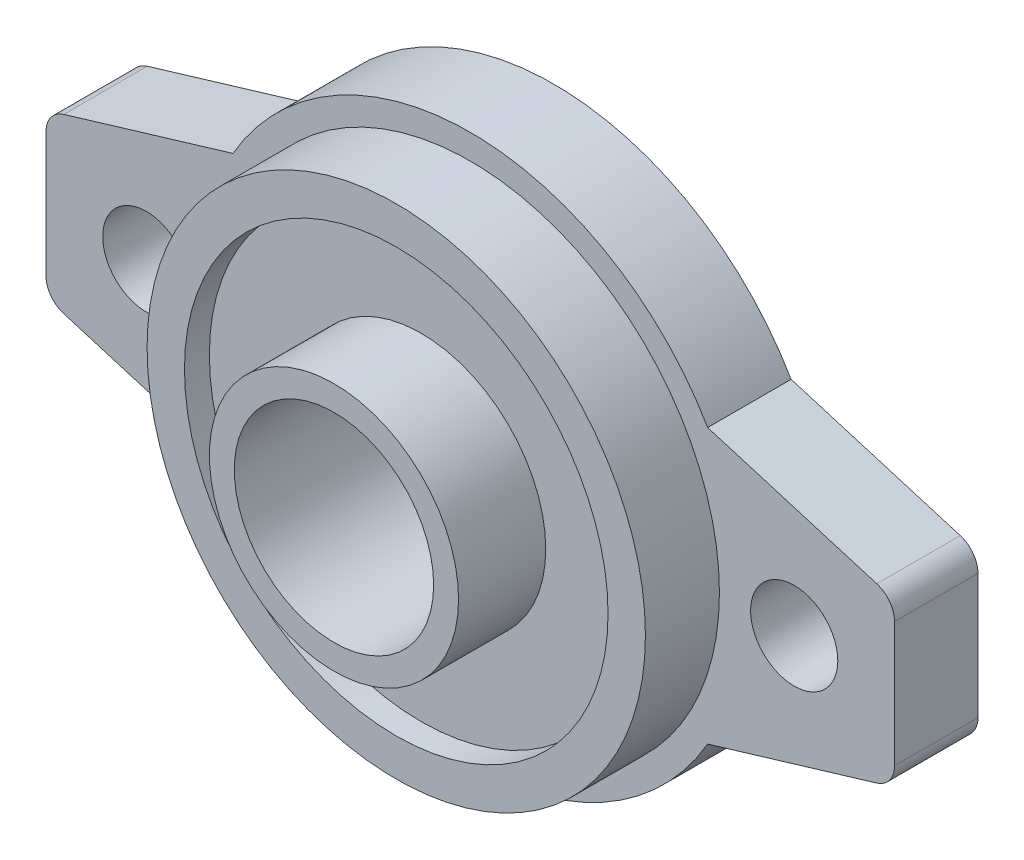
from build123d import *

# Parameters (mm, degrees)
SKETCH_1_R      = 10
SKETCH_1_R_2    = 3.5
EXTRUDE_1_DEPTH = 6.7
SKETCH_1_4_R    = 20
SKETCH_1_4_R_2  = 17
EXTRUDE_2_DEPTH = 12.64
SKETCH_1_5_R    = 17
SKETCH_1_5_R_2  = 10
EXTRUDE_3_DEPTH = 10.64
SKETCH_1_6_R    = 10
SKETCH_1_6_R_2  = 8
EXTRUDE_4_DEPTH = 17.64
FILLET_1_R      = 2


with BuildPart() as part:
    # 스케치1 → 보스-돌출1 (new body)
    with BuildSketch(Plane.XY):
        with BuildLine():
            Line((19.052558883, 11), (34.052558883, 6.5))
            Line((34.052558883, 6.5), (34.052558883, -6.5))
            Line((34.052558883, -6.5), (19.052558883, -11))
            ThreePointArc((19.052558883, -11), (0, -22), (-19.052558883, -11))
            Line((-19.052558883, -11), (-34.052558883, -6.5))
            Line((-34.052558883, -6.5), (-34.052558883, 6.5))
            Line((-34.052558883, 6.5), (-19.052558883, 11))
            ThreePointArc((-19.052558883, 11), (0, 22), (19.052558883, 11))
        make_face()
        Circle(SKETCH_1_R, mode=Mode.SUBTRACT)
        with Locations((26, 0)):
            Circle(SKETCH_1_R_2, mode=Mode.SUBTRACT)
        with Locations((-26, 0)):
            Circle(SKETCH_1_R_2, mode=Mode.SUBTRACT)
    extrude(amount=EXTRUDE_1_DEPTH)

    # 스케치1<4> → 보스-돌출2 (add)
    with BuildSketch(Plane.XY):
        with Locations(Location((0, 0, 0), (0, 0, 180))):
            Circle(SKETCH_1_4_R)
        with Locations(Location((0, 0, 0), (0, 0, 180))):
            Circle(SKETCH_1_4_R_2, mode=Mode.SUBTRACT)
    extrude(amount=EXTRUDE_2_DEPTH)

    # 스케치1<5> → 보스-돌출3 (add)
    with BuildSketch(Plane.XY):
        with Locations(Location((0, 0, 0), (0, 0, 180))):
            Circle(SKETCH_1_5_R)
        Circle(SKETCH_1_5_R_2, mode=Mode.SUBTRACT)
    extrude(amount=EXTRUDE_3_DEPTH)

    # 스케치1<6> → 보스-돌출4 (add)
    with BuildSketch(Plane.XY):
        Circle(SKETCH_1_6_R)
        Circle(SKETCH_1_6_R_2, mode=Mode.SUBTRACT)
    extrude(amount=EXTRUDE_4_DEPTH)

    # 필렛1
    fillet_1_edges = [part.edges().sort_by_distance(p)[0] for p in [
        (-34.052558883, -6.5, 3.35),
        (-34.052558883, 6.5, 3.35),
        (34.052558883, 6.5, 3.35),
        (34.052558883, -6.5, 3.35),
    ]]
    fillet(fillet_1_edges, radius=FILLET_1_R)


solid = part.part
